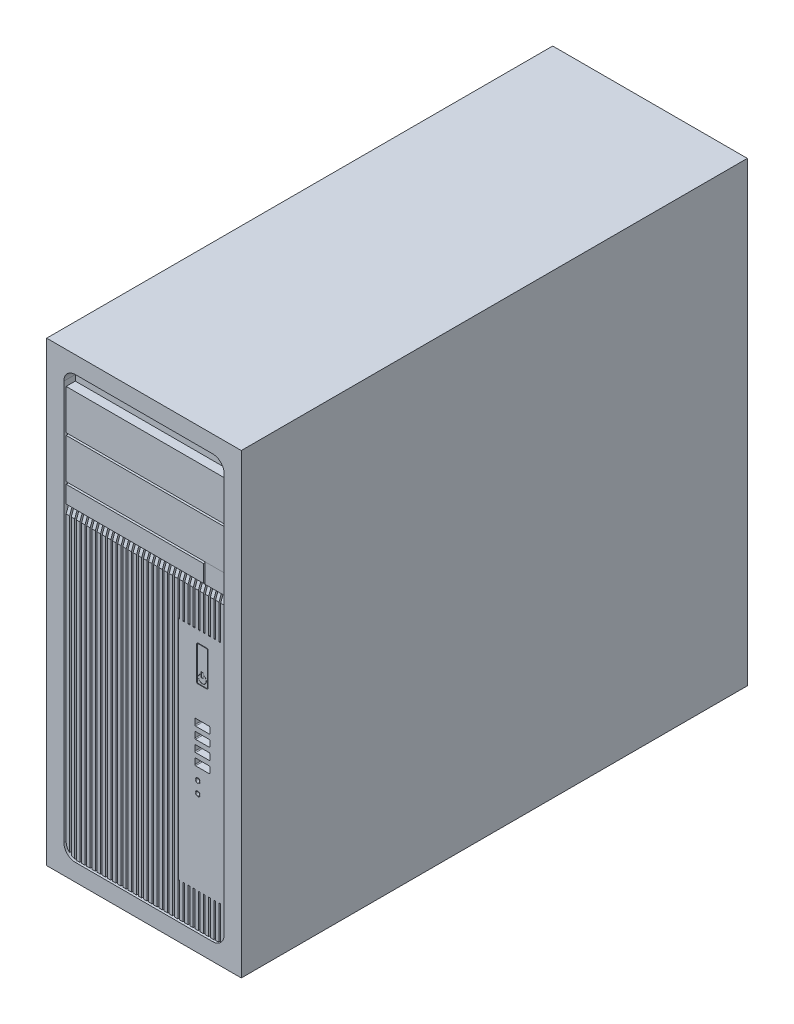
from build123d import *

# Parameters (mm, degrees)
SKETCH1_W             = 170
SKETCH1_H             = 442
BOSS_EXTRUDE1_DEPTH   = 399
CUT_EXTRUDE1_DEPTH    = 10
SKETCH3_W             = 140
SKETCH3_H             = 35
BOSS_EXTRUDE2_DEPTH   = 8
SKETCH4_W             = 120
SKETCH4_H             = 15
BOSS_EXTRUDE3_DEPTH   = 8
SKETCH4_W_2           = 18.906176259
SKETCH4_H_2           = 17
BOSS_EXTRUDE3_2_DEPTH = 8
BOSS_EXTRUDE4_START   = 8
BOSS_EXTRUDE4_DEPTH   = 8
CHAMFER1_SIZE         = 2
CHAMFER1_SIZE2        = 5.494954839
CUT_EXTRUDE2_DEPTH    = 8
SKETCH7_W             = 1.5
SKETCH7_H             = 263
CUT_EXTRUDE3_DEPTH    = 8
BOSS_EXTRUDE5_DEPTH   = 8
SKETCH9_W             = 42
SKETCH9_H             = 197.505045161
BOSS_EXTRUDE6_DEPTH   = 8
CUT_EXTRUDE4_DEPTH    = 8
SKETCH11_W            = 1.6
SKETCH11_H            = 4
SKETCH11_W_2          = 0.2
SKETCH11_H_2          = 0.2
CUT_EXTRUDE5_DEPTH    = 1
CUT_EXTRUDE6_DEPTH    = 8
SKETCH14_R            = 2.1
SKETCH14_R_2          = 1.9
SKETCH14_R_3          = 1.7
CUT_EXTRUDE7_DEPTH    = 8


with BuildPart() as part:
    # Sketch1 → Boss-Extrude1 (new body)
    with BuildSketch(Plane(origin=(0, 0, 0), x_dir=(1, 0, 0), z_dir=(0, 1, 0))):
        Rectangle(SKETCH1_W, SKETCH1_H)
    extrude(amount=BOSS_EXTRUDE1_DEPTH)

    # Sketch2 → Cut-Extrude1 (cut)
    with BuildSketch(Plane.XY.offset(221)):
        with BuildLine():
            Line((-60, 15), (60, 15))
            ThreePointArc((60, 15), (67.071067812, 17.928932188), (70, 25))
            Line((70, 25), (70, 374))
            ThreePointArc((70, 374), (67.071067812, 381.071067812), (60, 384))
            Line((60, 384), (-60, 384))
            ThreePointArc((-60, 384), (-67.071067812, 381.071067812), (-70, 374))
            Line((-70, 374), (-70, 25))
            ThreePointArc((-70, 25), (-67.071067812, 17.928932188), (-60, 15))
        make_face()
    extrude(amount=-CUT_EXTRUDE1_DEPTH, mode=Mode.SUBTRACT)

    # Sketch3 → Boss-Extrude2 (add)
    with BuildSketch(Plane.XY.offset(211)):
        with Locations((0, 351.5)):
            Rectangle(SKETCH3_W, SKETCH3_H)
        with Locations((0, 314.5)):
            Rectangle(SKETCH3_W, SKETCH3_H)
    extrude(amount=BOSS_EXTRUDE2_DEPTH)

    # Sketch5 → Boss-Extrude4 (add)
    with BuildSketch(Plane.XY.offset(211).offset(BOSS_EXTRUDE4_START)):
        with BuildLine():
            Line((-60, 15), (60, 15))
            ThreePointArc((60, 15), (67.071067812, 17.928932188), (70, 25))
            Line((70, 25), (70, 278))
            Line((70, 278), (-70, 278))
            Line((-70, 278), (-70, 25))
            ThreePointArc((-70, 25), (-67.071067812, 17.928932188), (-60, 15))
        make_face()
    extrude(amount=-BOSS_EXTRUDE4_DEPTH)

    # Chamfer1
    chamfer1_edges = [part.edges().sort_by_distance(p)[0] for p in [
        (0, 278, 219),
    ]]
    chamfer1_side = [part.faces().sort_by_distance(p)[0] for p in [
        (0, 278, 215),
    ]]
    chamfer(chamfer1_edges, length=CHAMFER1_SIZE, length2=CHAMFER1_SIZE2, reference=chamfer1_side[0])

    # Sketch6 → Cut-Extrude2 (cut)
    with BuildSketch(Plane.XY.offset(219)):
        with BuildLine():
            Line((-65.5, 278), (-67, 278))
            Line((-67, 278), (-67, 17.858571571))
            ThreePointArc((-67, 17.858571571), (-66.279224233, 17.217240655), (-65.5, 16.648353456))
            Line((-65.5, 16.648353456), (-65.5, 278))
        make_face()
    extrude(amount=-CUT_EXTRUDE2_DEPTH, mode=Mode.SUBTRACT)

    # Sketch7 → Cut-Extrude3 (cut)
    with BuildSketch(Plane.XY.offset(219)):
        with Locations((-61.75, 146.5)):
            Rectangle(SKETCH7_W, SKETCH7_H)
        with Locations((-57.25, 146.5)):
            Rectangle(SKETCH7_W, SKETCH7_H)
        with Locations((-52.75, 146.5)):
            Rectangle(SKETCH7_W, SKETCH7_H)
        with Locations((-48.25, 146.5)):
            Rectangle(SKETCH7_W, SKETCH7_H)
        with Locations((-43.75, 146.5)):
            Rectangle(SKETCH7_W, SKETCH7_H)
        with Locations((-39.25, 146.5)):
            Rectangle(SKETCH7_W, SKETCH7_H)
        with Locations((-34.75, 146.5)):
            Rectangle(SKETCH7_W, SKETCH7_H)
        with Locations((-30.25, 146.5)):
            Rectangle(SKETCH7_W, SKETCH7_H)
        with Locations((-25.75, 146.5)):
            Rectangle(SKETCH7_W, SKETCH7_H)
        with Locations((-21.25, 146.5)):
            Rectangle(SKETCH7_W, SKETCH7_H)
        with Locations((-16.75, 146.5)):
            Rectangle(SKETCH7_W, SKETCH7_H)
        with Locations((-12.25, 146.5)):
            Rectangle(SKETCH7_W, SKETCH7_H)
        with Locations((-7.75, 146.5)):
            Rectangle(SKETCH7_W, SKETCH7_H)
        with Locations((-3.25, 146.5)):
            Rectangle(SKETCH7_W, SKETCH7_H)
        with Locations((1.25, 146.5)):
            Rectangle(SKETCH7_W, SKETCH7_H)
        with Locations((5.75, 146.5)):
            Rectangle(SKETCH7_W, SKETCH7_H)
        with Locations((10.25, 146.5)):
            Rectangle(SKETCH7_W, SKETCH7_H)
        with Locations((14.75, 146.5)):
            Rectangle(SKETCH7_W, SKETCH7_H)
        with Locations((19.25, 146.5)):
            Rectangle(SKETCH7_W, SKETCH7_H)
        with Locations((23.75, 146.5)):
            Rectangle(SKETCH7_W, SKETCH7_H)
        with Locations((28.25, 146.5)):
            Rectangle(SKETCH7_W, SKETCH7_H)
        with Locations((32.75, 146.5)):
            Rectangle(SKETCH7_W, SKETCH7_H)
        with Locations((37.25, 146.5)):
            Rectangle(SKETCH7_W, SKETCH7_H)
        with Locations((41.75, 146.5)):
            Rectangle(SKETCH7_W, SKETCH7_H)
        with Locations((46.25, 146.5)):
            Rectangle(SKETCH7_W, SKETCH7_H)
        with Locations((50.75, 146.5)):
            Rectangle(SKETCH7_W, SKETCH7_H)
        with Locations((55.25, 146.5)):
            Rectangle(SKETCH7_W, SKETCH7_H)
        with Locations((59.75, 146.5)):
            Rectangle(SKETCH7_W, SKETCH7_H)
        with Locations((64.25, 146.5)):
            Rectangle(SKETCH7_W, SKETCH7_H)
        with Locations((68.75, 146.5)):
            Rectangle(SKETCH7_W, SKETCH7_H)
    extrude(amount=-CUT_EXTRUDE3_DEPTH, mode=Mode.SUBTRACT)

    # Sketch8 → Boss-Extrude5 (add)
    with BuildSketch(Plane.XY.offset(219)):
        with BuildLine():
            ThreePointArc((60.5, 15.012507822), (60.250078211, 15.003127445), (60, 15))
            Line((60, 15), (70, 15))
            Line((70, 15), (70, 25))
            ThreePointArc((70, 25), (68.215838363, 19.299122875), (63.5, 15.632503002))
            ThreePointArc((63.5, 15.632503002), (62.023882039, 15.206946263), (60.5, 15.012507822))
        make_face()
    extrude(amount=-BOSS_EXTRUDE5_DEPTH)

    # Sketch9 → Boss-Extrude6 (add)
    with BuildSketch(Plane.XY.offset(219)):
        with Locations((49, 143.75252258)):
            Rectangle(SKETCH9_W, SKETCH9_H)
    extrude(amount=-BOSS_EXTRUDE6_DEPTH)

    # Sketch10 → Cut-Extrude4 (cut)
    with BuildSketch(Plane.XY.offset(219)):
        with BuildLine():
            Line((45.057177858, 201.505045161), (52.942822142, 201.505045161))
            ThreePointArc((52.942822142, 201.505045161), (53.649928923, 201.79793838), (53.942822142, 202.505045161))
            Line((53.942822142, 202.505045161), (53.942822142, 231.505045161))
            ThreePointArc((53.942822142, 231.505045161), (53.649928923, 232.212151942), (52.942822142, 232.505045161))
            Line((52.942822142, 232.505045161), (45.057177858, 232.505045161))
            ThreePointArc((45.057177858, 232.505045161), (44.350071077, 232.212151942), (44.057177858, 231.505045161))
            Line((44.057177858, 231.505045161), (44.057177858, 202.505045161))
            ThreePointArc((44.057177858, 202.505045161), (44.350071077, 201.79793838), (45.057177858, 201.505045161))
        make_face()
        with BuildLine():
            Line((45.557177858, 202.005045161), (52.442822142, 202.005045161))
            ThreePointArc((52.442822142, 202.005045161), (53.149928923, 202.29793838), (53.442822142, 203.005045161))
            Line((53.442822142, 203.005045161), (53.442822142, 231.005045161))
            ThreePointArc((53.442822142, 231.005045161), (53.149928923, 231.712151942), (52.442822142, 232.005045161))
            Line((52.442822142, 232.005045161), (45.557177858, 232.005045161))
            ThreePointArc((45.557177858, 232.005045161), (44.850071077, 231.712151942), (44.557177858, 231.005045161))
            Line((44.557177858, 231.005045161), (44.557177858, 203.005045161))
            ThreePointArc((44.557177858, 203.005045161), (44.850071077, 202.29793838), (45.557177858, 202.005045161))
        make_face(mode=Mode.SUBTRACT)
    extrude(amount=-CUT_EXTRUDE4_DEPTH, mode=Mode.SUBTRACT)

    # Sketch11 → Cut-Extrude5 (cut)
    # profile 1 of 5: a face of its own
    with BuildSketch(Plane.XY.offset(219)):
        Polygon((48, 212.005045161), (48, 207.805045161), (50, 207.805045161), (50, 212.205045161), (48.2, 212.205045161), (48.2, 212.005045161), align=None)
        with Locations((49, 210.005045161)):
            Rectangle(SKETCH11_W, SKETCH11_H, mode=Mode.SUBTRACT)
    # profile 2 of 5: a face of its own
    with BuildSketch(Plane.XY.offset(219)):
        with BuildLine():
            Line((52.3, 207.005045161), (52.5, 207.005045161))
            ThreePointArc((52.5, 207.005045161), (51.967720543, 208.860479013), (50.532780127, 210.15156468))
            Line((50.532780127, 210.15156468), (50.532780127, 209.927473104))
            ThreePointArc((50.532780127, 209.927473104), (51.823842632, 208.712649562), (52.3, 207.005045161))
        make_face()
    # profile 3 of 5: a face of its own
    with BuildSketch(Plane.XY.offset(219)):
        with Locations((48.1, 212.105045161)):
            Rectangle(SKETCH11_W_2, SKETCH11_H_2)
    # profile 4 of 5: a face of its own
    with BuildSketch(Plane.XY.offset(219)):
        with BuildLine():
            ThreePointArc((47.467219873, 210.15156468), (46.032279457, 208.860479013), (45.5, 207.005045161))
            Line((45.5, 207.005045161), (45.7, 207.005045161))
            ThreePointArc((45.7, 207.005045161), (46.176157368, 208.712649562), (47.467219873, 209.927473104))
            Line((47.467219873, 209.927473104), (47.467219873, 210.15156468))
        make_face()
    # profile 5 of 5: a face of its own
    with BuildSketch(Plane.XY.offset(219)):
        with BuildLine():
            Line((45.7, 207.005045161), (45.5, 207.005045161))
            ThreePointArc((45.5, 207.005045161), (49, 203.505045161), (52.5, 207.005045161))
            Line((52.5, 207.005045161), (52.3, 207.005045161))
            ThreePointArc((52.3, 207.005045161), (49, 203.705045161), (45.7, 207.005045161))
        make_face()
    extrude(amount=-CUT_EXTRUDE5_DEPTH, mode=Mode.SUBTRACT)

    # Sketch13 → Cut-Extrude6 (cut)
    with BuildSketch(Plane.XY.offset(219)):
        with BuildLine():
            Line((42.35, 163.705045161), (42.35, 159.305045161))
            ThreePointArc((42.35, 159.305045161), (42.572598846, 158.767644007), (43.11, 158.545045161))
            Line((43.11, 158.545045161), (54.89, 158.545045161))
            ThreePointArc((54.89, 158.545045161), (55.427401154, 158.767644007), (55.65, 159.305045161))
            Line((55.65, 159.305045161), (55.65, 163.705045161))
            ThreePointArc((55.65, 163.705045161), (55.427401154, 164.242446315), (54.89, 164.465045161))
            Line((54.89, 164.465045161), (43.11, 164.465045161))
            ThreePointArc((43.11, 164.465045161), (42.572598846, 164.242446315), (42.35, 163.705045161))
        make_face()
        with BuildLine():
            ThreePointArc((42.35, 173.705045161), (42.572598846, 174.242446315), (43.11, 174.465045161))
            Line((43.11, 174.465045161), (54.89, 174.465045161))
            ThreePointArc((54.89, 174.465045161), (55.427401154, 174.242446315), (55.65, 173.705045161))
            Line((55.65, 173.705045161), (55.65, 169.305045161))
            ThreePointArc((55.65, 169.305045161), (55.427401154, 168.767644007), (54.89, 168.545045161))
            Line((54.89, 168.545045161), (43.11, 168.545045161))
            ThreePointArc((43.11, 168.545045161), (42.572598846, 168.767644007), (42.35, 169.305045161))
            Line((42.35, 169.305045161), (42.35, 173.705045161))
        make_face()
        with BuildLine():
            Line((42.35, 153.705045161), (42.35, 149.305045161))
            ThreePointArc((42.35, 149.305045161), (42.572598846, 148.767644007), (43.11, 148.545045161))
            Line((43.11, 148.545045161), (54.89, 148.545045161))
            ThreePointArc((54.89, 148.545045161), (55.427401154, 148.767644007), (55.65, 149.305045161))
            Line((55.65, 149.305045161), (55.65, 153.705045161))
            ThreePointArc((55.65, 153.705045161), (55.427401154, 154.242446315), (54.89, 154.465045161))
            Line((54.89, 154.465045161), (43.11, 154.465045161))
            ThreePointArc((43.11, 154.465045161), (42.572598846, 154.242446315), (42.35, 153.705045161))
        make_face()
        with BuildLine():
            Line((42.35, 143.705045161), (42.35, 139.305045161))
            ThreePointArc((42.35, 139.305045161), (42.572598846, 138.767644007), (43.11, 138.545045161))
            Line((43.11, 138.545045161), (54.89, 138.545045161))
            ThreePointArc((54.89, 138.545045161), (55.427401154, 138.767644007), (55.65, 139.305045161))
            Line((55.65, 139.305045161), (55.65, 143.705045161))
            ThreePointArc((55.65, 143.705045161), (55.427401154, 144.242446315), (54.89, 144.465045161))
            Line((54.89, 144.465045161), (43.11, 144.465045161))
            ThreePointArc((43.11, 144.465045161), (42.572598846, 144.242446315), (42.35, 143.705045161))
        make_face()
    extrude(amount=-CUT_EXTRUDE6_DEPTH, mode=Mode.SUBTRACT)

    # Sketch14 → Cut-Extrude7 (cut)
    # profile 1 of 4: a face of its own
    with BuildSketch(Plane.XY.offset(219)):
        with Locations((44.980068853, 128.330572484)):
            Circle(SKETCH14_R)
        with Locations((44.980068853, 128.330572484)):
            Circle(SKETCH14_R_2, mode=Mode.SUBTRACT)
    # profile 2 of 4: a face of its own
    with BuildSketch(Plane.XY.offset(219)):
        with Locations((44.980068853, 128.330572484)):
            Circle(SKETCH14_R_3)
    # profile 3 of 4: a face of its own
    with BuildSketch(Plane.XY.offset(219)):
        with Locations((44.980068853, 118.330572484)):
            Circle(SKETCH14_R)
        with Locations((44.980068853, 118.330572484)):
            Circle(SKETCH14_R_2, mode=Mode.SUBTRACT)
    # profile 4 of 4: a face of its own
    with BuildSketch(Plane.XY.offset(219)):
        with Locations((44.980068853, 118.330572484)):
            Circle(SKETCH14_R_3)
    extrude(amount=-CUT_EXTRUDE7_DEPTH, mode=Mode.SUBTRACT)


with BuildPart() as body_2:
    # Sketch4 → Boss-Extrude3 (new body)
    with BuildSketch(Plane.XY.offset(211)):
        with Locations((-10, 287.5)):
            Rectangle(SKETCH4_W, SKETCH4_H)
    extrude(amount=BOSS_EXTRUDE3_DEPTH)


with BuildPart() as body_3:
    # Sketch4 → Boss-Extrude3 2 (new body)
    with BuildSketch(Plane.XY.offset(211)):
        with Locations((60.54691187, 288.5)):
            Rectangle(SKETCH4_W_2, SKETCH4_H_2)
    extrude(amount=BOSS_EXTRUDE3_2_DEPTH)


solid = Compound([part.part, body_2.part, body_3.part])
